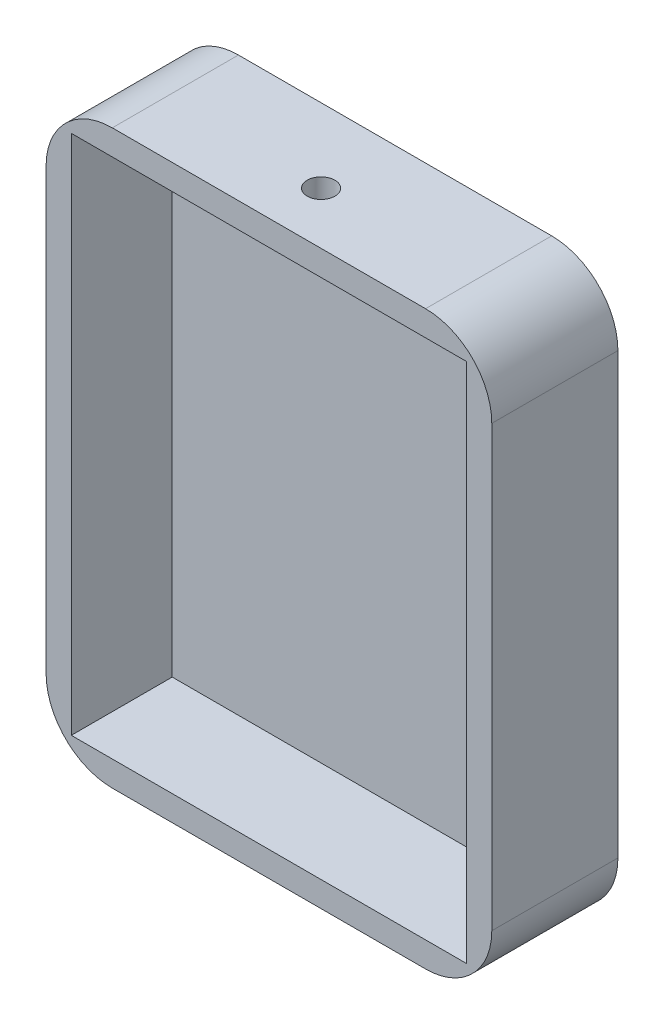
from build123d import *

# Parameters (mm, degrees)
SKETCH1_W           = 67.31
SKETCH1_H           = 86.36
BOSS_EXTRUDE1_DEPTH = 19.05
SHELL1_T            = -3.81
FILLET3_R           = 10
CUT_EXTRUDE1_REACH  = 96.624
SKETCH2_R           = 2.0955


with BuildPart() as part:
    # Sketch1 → Boss-Extrude1 (new body)
    with BuildSketch(Plane.XY):
        Rectangle(SKETCH1_W, SKETCH1_H)
    extrude(amount=BOSS_EXTRUDE1_DEPTH)

    # Shell1
    shell1_openings = [part.faces().sort_by_distance(p)[0] for p in [
        (0, 0, 19.05),
    ]]
    offset(amount=SHELL1_T, openings=shell1_openings, kind=Kind.INTERSECTION)

    # Fillet3
    fillet3_edges = [part.edges().sort_by_distance(p)[0] for p in [
        (33.655, -43.18, 9.525),
        (-33.655, -43.18, 9.525),
        (-33.655, 43.18, 9.525),
        (33.655, 43.18, 9.525),
    ]]
    fillet(fillet3_edges, radius=FILLET3_R)

    # Sketch2 → Cut-Extrude1 (cut, up to next)
    with BuildSketch(Plane(origin=(0, 43.18, 0), x_dir=(1, 0, 0), z_dir=(0, 1, 0)), mode=Mode.PRIVATE) as cut_extrude1_sk1:
        with Locations(Location((0, -11.176, 0), (0, 0, 270))):
            Circle(SKETCH2_R)
    cut_extrude1_tool1 = extrude(cut_extrude1_sk1.sketch, amount=-CUT_EXTRUDE1_REACH, mode=Mode.PRIVATE) & part.part
    add(cut_extrude1_tool1.solids().sort_by_distance((0, 43.18, 11.176))[0], mode=Mode.SUBTRACT)


solid = part.part
